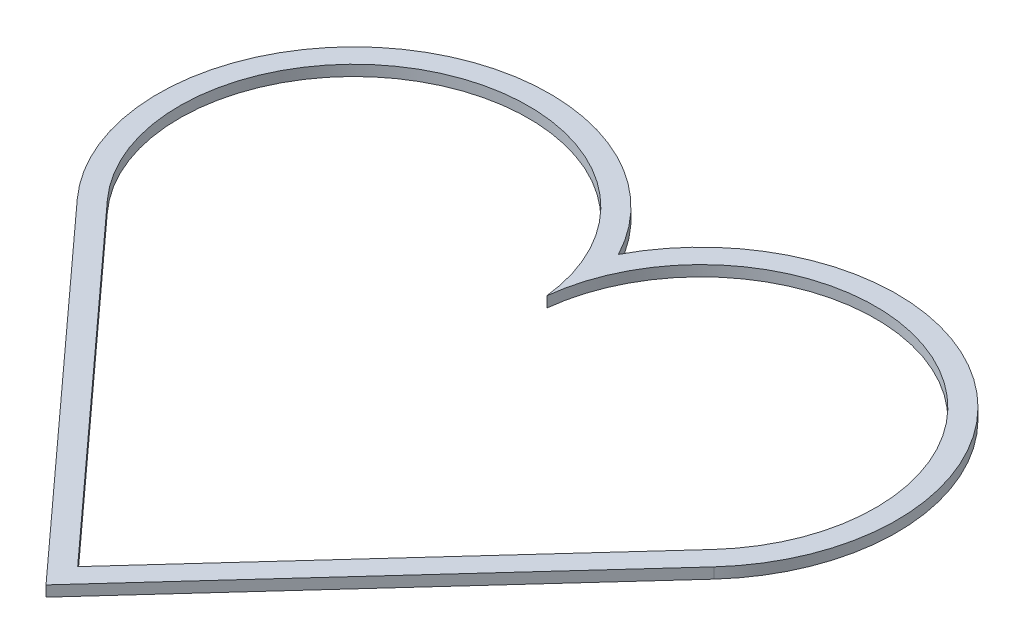
from build123d import *

# Parameters (mm, degrees)
BOSS_EXTRUDE2_DEPTH = 1


with BuildPart() as part:
    # Sketch1 → Boss-Extrude2 (new body)
    with BuildSketch(Plane(origin=(0, 0, 0), x_dir=(1, 0, 0), z_dir=(0, 1, 0))):
        with BuildLine():
            Line((0, -2.970477964), (29.886420182, 29.84931356))
            ThreePointArc((29.886420182, 29.84931356), (26.834835807, 57.297903562), (0, 50.768826482))
            ThreePointArc((0, 50.768826482), (-26.834835807, 57.297903562), (-29.886420182, 29.84931356))
            Line((-29.886420182, 29.84931356), (0, -2.970477964))
        make_face()
        with BuildLine():
            Line((0, 0), (28.407667395, 31.1958982))
            ThreePointArc((28.407667395, 31.1958982), (23.047800089, 57.163629593), (0, 44.054466297))
            ThreePointArc((0, 44.054466297), (-23.047800089, 57.163629593), (-28.407667395, 31.1958982))
            Line((-28.407667395, 31.1958982), (0, 0))
        make_face(mode=Mode.SUBTRACT)
    extrude(amount=BOSS_EXTRUDE2_DEPTH)


solid = part.part
